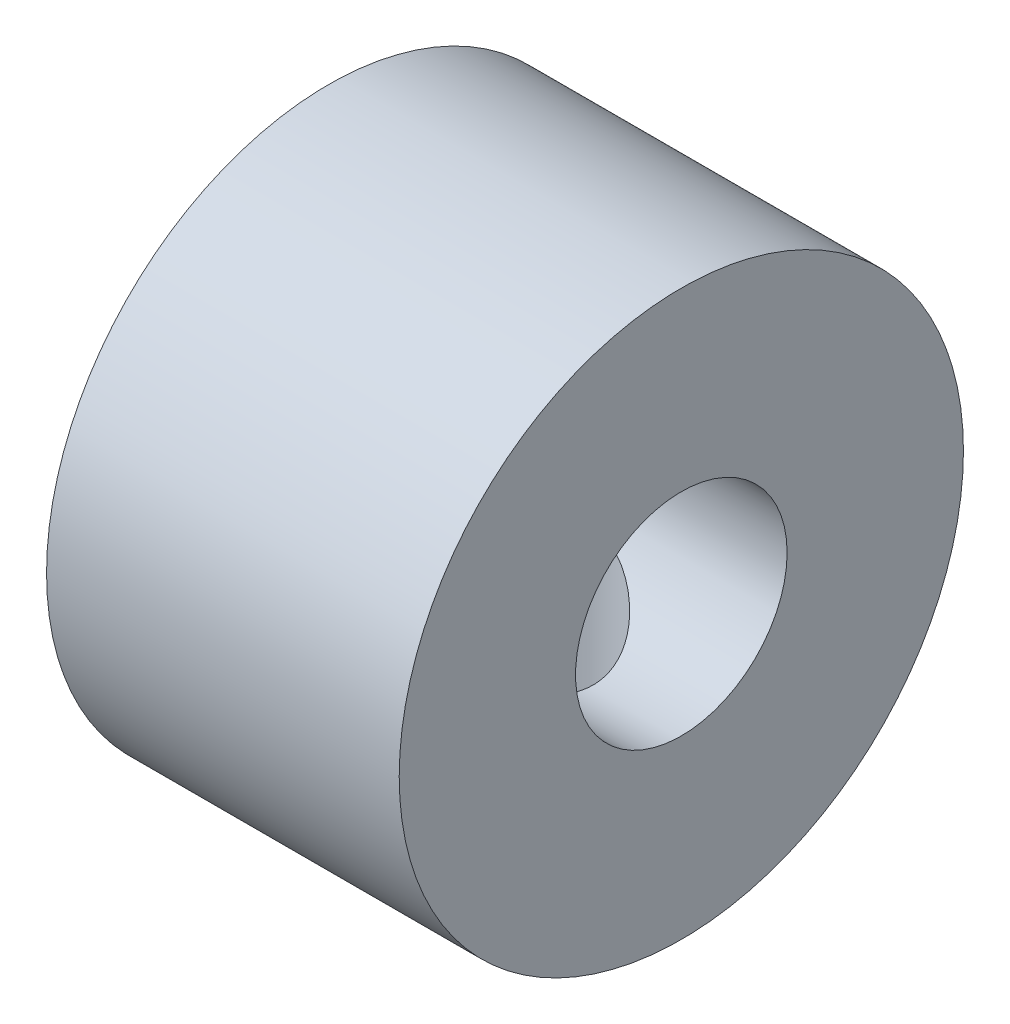
from build123d import *

# Parameters (mm, degrees)
SKETCH1_R           = 4
SKETCH1_R_2         = 1.5
BOSS_EXTRUDE1_DEPTH = 5
SKETCH2_R           = 1.25
CUT_EXTRUDE2_DEPTH  = 8.549834435


with BuildPart() as part:
    # Sketch1 → Boss-Extrude1 (new body)
    with BuildSketch(Plane(origin=(0, 0, 0), x_dir=(0, 0, -1), z_dir=(1, 0, 0))):
        Circle(SKETCH1_R)
        Circle(SKETCH1_R_2, mode=Mode.SUBTRACT)
    extrude(amount=BOSS_EXTRUDE1_DEPTH)

    # Sketch2 → Cut-Extrude2 (cut, through all)
    with BuildSketch(Plane(origin=(0, 0, 0), x_dir=(1, 0, 0), z_dir=(0, 1, 0))):
        with Locations(Location((2.5, 0, 0), (0, 0, 270))):
            Circle(SKETCH2_R)
    extrude(amount=-CUT_EXTRUDE2_DEPTH, mode=Mode.SUBTRACT)


solid = part.part
